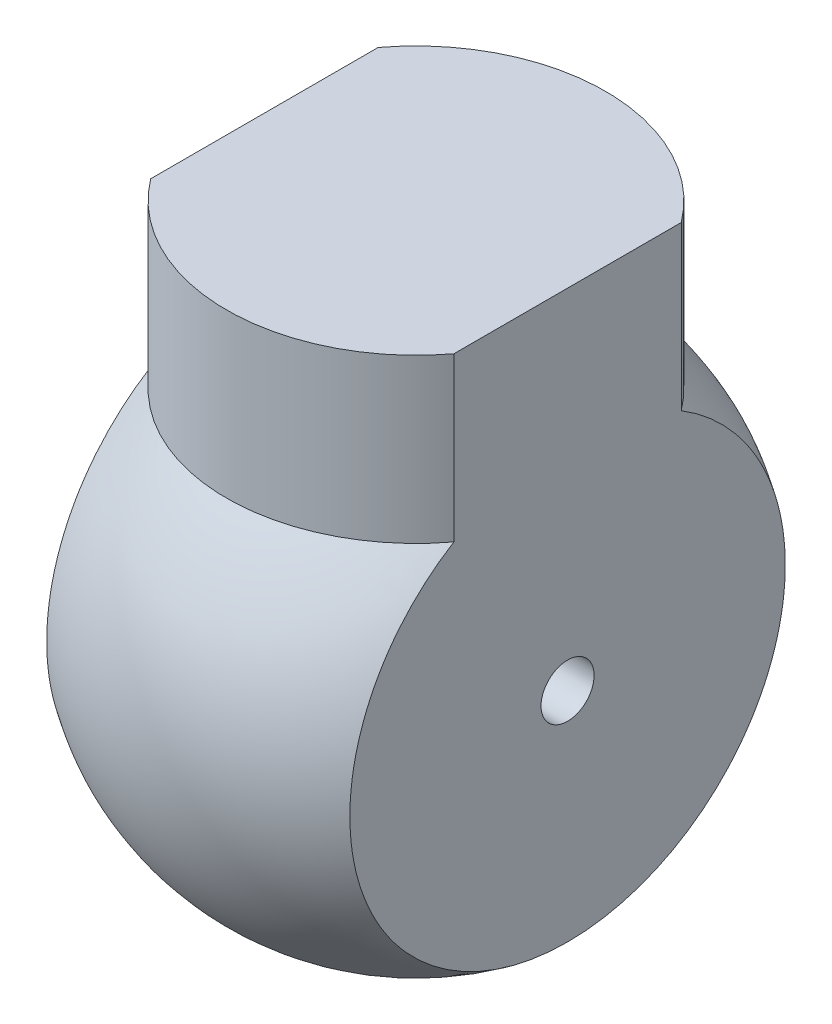
from build123d import *
from build123d.topology import SkipClean

# Parameters (mm, degrees)
CUT_EXTRUDE1_DEPTH      = 35
CUT_EXTRUDE1_DEPTH_BACK = 35
SKETCH2_OUTSIDE_W       = 96.248
SKETCH2_OUTSIDE_H       = 96.248
BOSS_EXTRUDE1_DEPTH     = 46
SKETCH4_R               = 3.5
CUT_EXTRUDE2_DEPTH      = 5
LPATTERN1_COUNT         = 2
LPATTERN1_PITCH         = 35
SCALE1_SCALE            = 0.2286


with BuildPart() as part:
    # Sketch1 → Revolve2 (revolve)
    with BuildSketch(Plane(origin=(0, 0, 0), x_dir=(1, 0, 0), z_dir=(0, 1, 0))):
        with BuildLine():
            Line((0, 35), (0, -35))
            ThreePointArc((0, -35), (35, 0), (0, 35))
        make_face()
    revolve(axis=Axis((0, 0, -35), (0, 0, 1)))

    # Sketch2 outside → Cut-Extrude1 (cut, two sides: drawn at the far end of the back side and taken through both)
    with SkipClean():  # the faces are left unmerged after this step: merging them gives an invalid solid
        with BuildSketch(Plane(origin=(0, 0, 0), x_dir=(1, 0, 0), z_dir=(0, 1, 0)).offset(-CUT_EXTRUDE1_DEPTH_BACK)):
            Rectangle(SKETCH2_OUTSIDE_W, SKETCH2_OUTSIDE_H)
            with BuildLine():
                Line((-20, -28.722813233), (-20, 28.722813233))
                ThreePointArc((-20, 28.722813233), (0, 35), (20, 28.722813233))
                Line((20, 28.722813233), (20, -28.722813233))
                ThreePointArc((20, -28.722813233), (0, -35), (-20, -28.722813233))
            make_face(mode=Mode.SUBTRACT)
        extrude(amount=CUT_EXTRUDE1_DEPTH + CUT_EXTRUDE1_DEPTH_BACK, mode=Mode.SUBTRACT)

    # Sketch3 → Boss-Extrude1 (add)
    with BuildSketch(Plane(origin=(0, 0, 0), x_dir=(1, 0, 0), z_dir=(0, 1, 0))):
        with BuildLine():
            Line((-20, 15), (-20, -15))
            ThreePointArc((-20, -15), (0, -25), (20, -15))
            Line((20, -15), (20, 15))
            ThreePointArc((20, 15), (0, 25), (-20, 15))
        make_face()
    extrude(amount=BOSS_EXTRUDE1_DEPTH)

    # Sketch4 → Cut-Extrude2 (cut)
    with BuildSketch(Plane.ZY.offset(20)):
        Circle(SKETCH4_R)
    cut_extrude2 = extrude(amount=-CUT_EXTRUDE2_DEPTH, mode=Mode.SUBTRACT)

    # LPattern1: Cut-Extrude2 ×2
    with Locations(*[(i * LPATTERN1_PITCH, 0, 0) for i in range(1, LPATTERN1_COUNT)]):
        add(cut_extrude2, mode=Mode.SUBTRACT)


with BuildPart() as part_1:
    # Scale1: scaled about (-2.48e-07, 6.314524212, 6.409e-06)
    add(part.part.scale(SCALE1_SCALE).moved(Location((-1.91e-07, 4.871023977, 4.944e-06))))


solid = part_1.part
